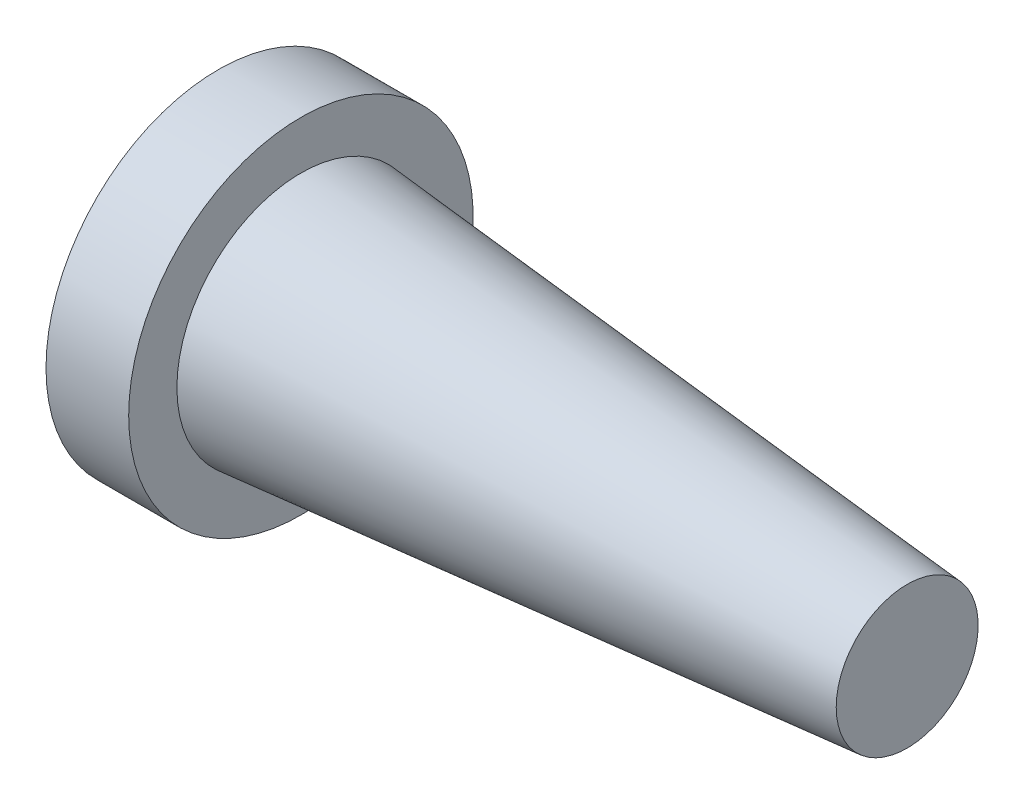
from build123d import *

# Parameters (mm, degrees)
SKETCH_9_R          = 5
CUT_EXTRUDE_2_DEPTH = 30
MM_1_D              = 4
MM_1_DEPTH          = 6
MM_1_TIP            = 1.201721238


with BuildPart() as part:
    # 草图5 → 旋转1 (revolve)
    with BuildSketch(Plane.XY, mode=Mode.PRIVATE) as revolve_1_sk:
        Polygon((-50, 0), (-50, 25), (-38, 25), (-38, 18), (50, 10.30099761), (50, 0), align=None)
    revolve(revolve_1_sk.sketch.rotate(Axis((-110.009795311, 0, 0), (1, 0, 0)), 90), axis=Axis((-110.009795311, 0, 0), (1, 0, 0)))

    # 草图9 → 切除-拉伸2 (cut)
    with BuildSketch(Plane.ZY.offset(50)):
        Circle(SKETCH_9_R)
    extrude(amount=-CUT_EXTRUDE_2_DEPTH, mode=Mode.SUBTRACT)

    # 大小mm 暗销孔1
    with Locations(Plane.ZY.offset(20)):
        with Locations((0, 0)):
            Hole(MM_1_D / 2, depth=MM_1_DEPTH)
            with Locations((0, 0, -(MM_1_DEPTH + MM_1_TIP / 2))):  # 118° drill point
                Cone(0, MM_1_D / 2, MM_1_TIP, mode=Mode.SUBTRACT)


solid = part.part
